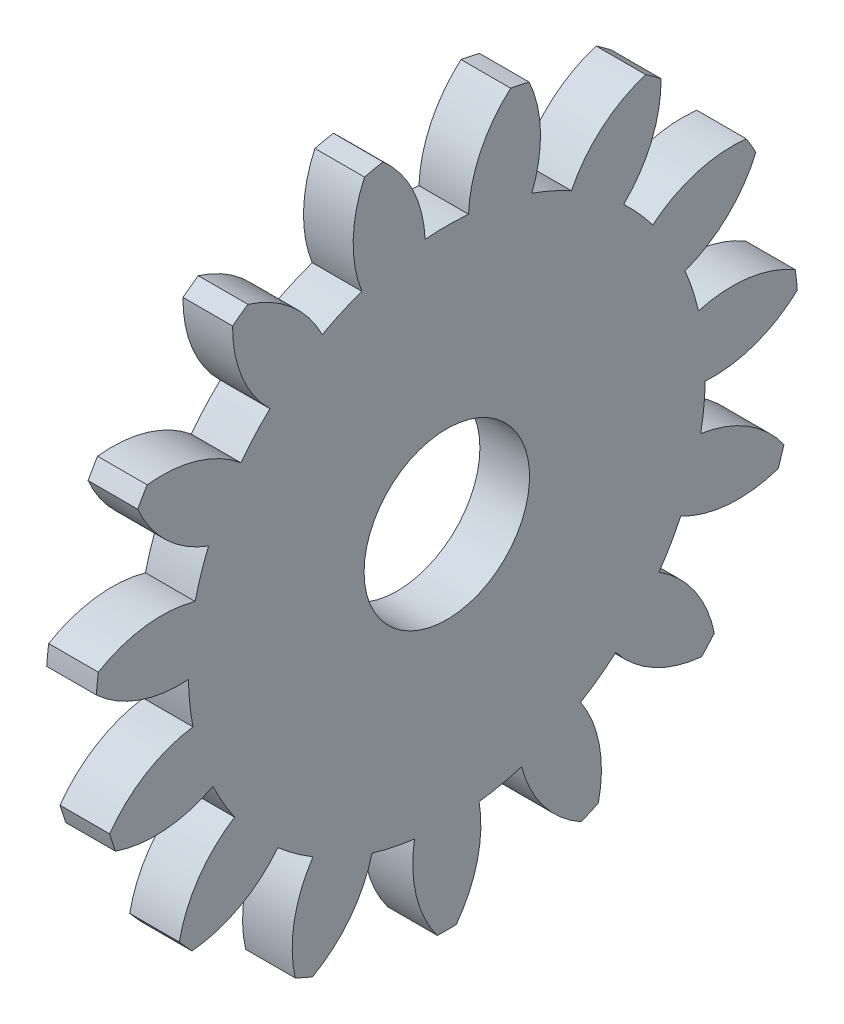
from build123d import *

# Parameters (mm, degrees)
BASPROSKE_W     = 6
BASPROSKE_H     = 42.5
TOOTHCUT_DEPTH  = 61.402814504
TEETHCUTS_COUNT = 15
TEETHCUTS_ANGLE = 336
BORSKE_R        = 10
BORE_DEPTH      = 50.0000508


with BuildPart() as part:
    # BasProSke → Base-Revolve (revolve)
    with BuildSketch(Plane(origin=(0, 0, 0), x_dir=(1, 0, 0), z_dir=(0, 1, 0)), mode=Mode.PRIVATE) as base_revolve_sk:
        with Locations((3, 21.25)):
            Rectangle(BASPROSKE_W, BASPROSKE_H)
    revolve(base_revolve_sk.sketch.rotate(Axis((-10, 0, 0), (1, 0, 0)), 180), axis=Axis((-10, 0, 0), (1, 0, 0)))

    # TooCutSke → ToothCut (cut, through all)
    with BuildSketch(Plane(origin=(0, 0, 0), x_dir=(0, 0, -1), z_dir=(1, 0, 0))):
        with BuildLine():
            ThreePointArc((2.624472836, 31.138595719), (0, 31.249), (-2.624472836, 31.138595719))
            ThreePointArc((-2.624472836, 31.138595719), (-4.084227986, 37.002862003), (-7.739685892, 41.815151649))
            ThreePointArc((-7.739685892, 41.815151649), (0, 42.5254), (7.739685892, 41.815151649))
            ThreePointArc((7.739685892, 41.815151649), (4.084227986, 37.002862003), (2.624472836, 31.138595719))
        make_face()
    toothcut = extrude(amount=TOOTHCUT_DEPTH, mode=Mode.SUBTRACT)

    # TeethCuts: ToothCut ×15 about axis
    teethcuts_axis = Axis((-10, 0, 0), (1, 0, 0))
    for i in range(1, TEETHCUTS_COUNT):
        add(toothcut.rotate(teethcuts_axis, i * TEETHCUTS_ANGLE / (TEETHCUTS_COUNT - 1)), mode=Mode.SUBTRACT)

    # BorSke → Bore (cut, symmetric)
    with BuildSketch(Plane(origin=(0, 0, 0), x_dir=(0, 0, -1), z_dir=(1, 0, 0))):
        with Locations(Location((0, 0, 0), (0, 0, 180))):
            Circle(BORSKE_R)
    extrude(amount=BORE_DEPTH, both=True, mode=Mode.SUBTRACT)


solid = part.part
